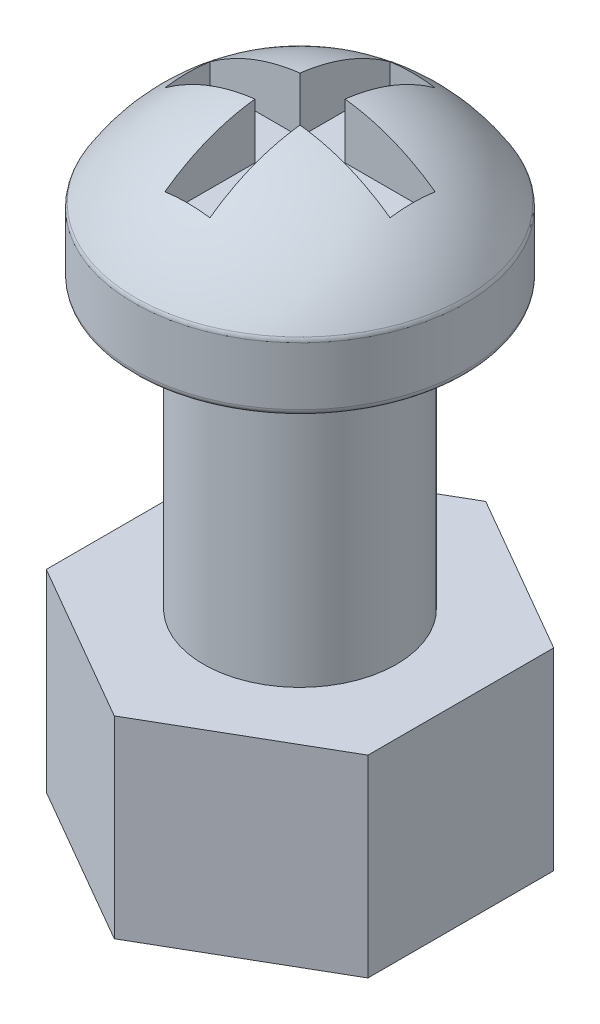
from build123d import *

# Parameters (mm, degrees)
BOSS_EXTRUDE1_DEPTH = 30
SKETCH1_4_R         = 1.5
BOSS_EXTRUDE2_DEPTH = 6
CUT_EXTRUDE1_DEPTH  = 4
FILLET1_R           = 0.1
SKETCH5_R           = 1.5
BOSS_EXTRUDE3_DEPTH = 3
SKETCH6_R           = 4.535168768
CUT_EXTRUDE2_DEPTH  = 33


with BuildPart() as part:
    # Sketch1 → Boss-Extrude1 (new body)
    with BuildSketch(Plane(origin=(0, 0, 0), x_dir=(1, 0, 0), z_dir=(0, 1, 0))):
        Polygon((2.5, -1.443375673), (2.5, 1.443375673), (0, 2.886751346), (-2.5, 1.443375673), (-2.5, -1.443375673), (0, -2.886751346), align=None)
    extrude(amount=BOSS_EXTRUDE1_DEPTH)

    # Sketch1<4> → Boss-Extrude2 (add)
    with BuildSketch(Plane(origin=(0, 0, 0), x_dir=(1, 0, 0), z_dir=(0, 1, 0))):
        Circle(SKETCH1_4_R)
    extrude(amount=-BOSS_EXTRUDE2_DEPTH)

    # Sketch3 → Revolve1 (revolve)
    with BuildSketch(Plane.XY):
        with BuildLine():
            Line((0, 30), (1.5, 30))
            Line((1.5, 30), (1.5, 34.4))
            Line((1.5, 34.4), (2.577677109, 34.4))
            Line((2.577677109, 34.4), (2.577677109, 35.4))
            ThreePointArc((2.577677109, 35.4), (2.572999105, 35.433876498), (2.559315235, 35.465217406))
            ThreePointArc((2.559315235, 35.465217406), (1.467028933, 36.516835132), (0, 36.9))
            Line((0, 36.9), (0, 30))
        make_face()
    revolve(axis=Axis((0, 30, 0), (0, -1, 0)))

    # Sketch4 → Cut-Extrude1 (cut)
    with BuildSketch(Plane(origin=(0, 40, 0), x_dir=(1, 0, 0), z_dir=(0, 1, 0))):
        Polygon((-1.75, 0.35), (-1.75, -0.35), (-0.35, -0.35), (-0.35, -1.75), (0.35, -1.75), (0.35, -0.35), (1.75, -0.35), (1.75, 0.35), (0.35, 0.35), (0.35, 1.75), (-0.35, 1.75), (-0.35, 0.35), align=None)
    extrude(amount=-CUT_EXTRUDE1_DEPTH, mode=Mode.SUBTRACT)

    # Fillet1
    fillet1_edges = [part.edges().sort_by_distance(p)[0] for p in [
        (-2.577677109, 34.4, 0),
    ]]
    fillet(fillet1_edges, radius=FILLET1_R)


with BuildPart() as body_2:
    # Sketch5 → Boss-Extrude3 (new body)
    with BuildSketch(Plane.XZ.offset(6)):
        Polygon((2.5, 1.443375673), (0, 2.886751346), (-2.5, 1.443375673), (-2.5, -1.443375673), (0, -2.886751346), (2.5, -1.443375673), align=None)
        Circle(SKETCH5_R, mode=Mode.SUBTRACT)
    extrude(amount=-BOSS_EXTRUDE3_DEPTH)


with BuildPart() as cut_extrude2_tool:
    # Sketch6 → Cut-Extrude2 (new body)
    with BuildSketch(Plane.XZ.offset(6)):
        Circle(SKETCH6_R)
    extrude(amount=-CUT_EXTRUDE2_DEPTH)


with BuildPart() as part_1:
    add(part.part)

    # Cut-Extrude2: cut by cut_extrude2_tool
    add(cut_extrude2_tool.part, mode=Mode.SUBTRACT)


with BuildPart() as body_2_1:
    add(body_2.part)

    # Cut-Extrude2: cut by cut_extrude2_tool
    add(cut_extrude2_tool.part, mode=Mode.SUBTRACT)


solid = part_1.part
